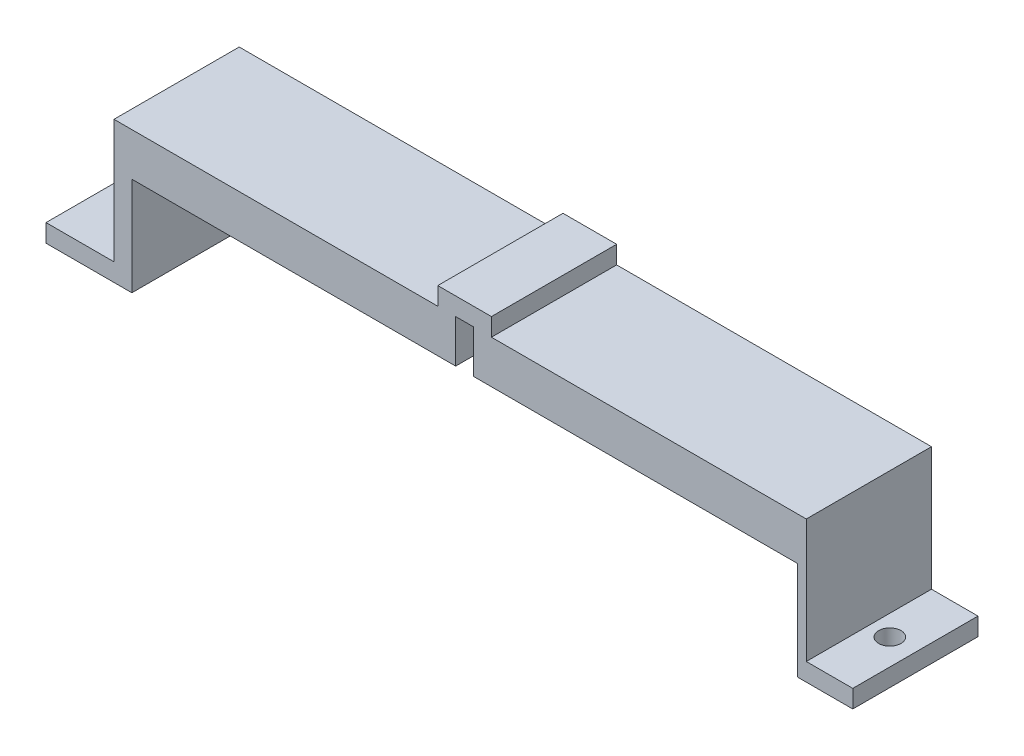
from build123d import *

# Parameters (mm, degrees)
BOSS_EXTRUDE1_DEPTH = 17.78
SKETCH4_R           = 1.5875
CUT_EXTRUDE1_DEPTH  = 66.571859971


with BuildPart() as part:
    # Sketch3 → Boss-Extrude1 (new body)
    with BuildSketch(Plane.XY):
        Polygon((2.54, -2.54), (5.08, -2.54), (5.08, -8.636), (51.054, -8.636), (51.054, -22.606), (58.928, -22.606), (58.928, -20.066), (52.324, -20.066), (52.324, -2.54), (7.62, -2.54), (7.62, 0), (0, 0), (0, -2.54), (-45.974, -2.54), (-45.974, -20.066), (-55.626, -20.066), (-55.626, -22.606), (-43.434, -22.606), (-43.434, -8.636), (2.54, -8.636), align=None)
    extrude(amount=BOSS_EXTRUDE1_DEPTH)

    # Sketch4 → Cut-Extrude1 (cut, through all)
    with BuildSketch(Plane.XZ.offset(22.606)):
        with Locations(Location((-51.943, 8.839936473, 0), (0, 0, 270))):
            Circle(SKETCH4_R)
        with Locations(Location((55.245, 8.839936473, 0), (0, 0, 270))):
            Circle(SKETCH4_R)
    extrude(amount=-CUT_EXTRUDE1_DEPTH, mode=Mode.SUBTRACT)


solid = part.part
